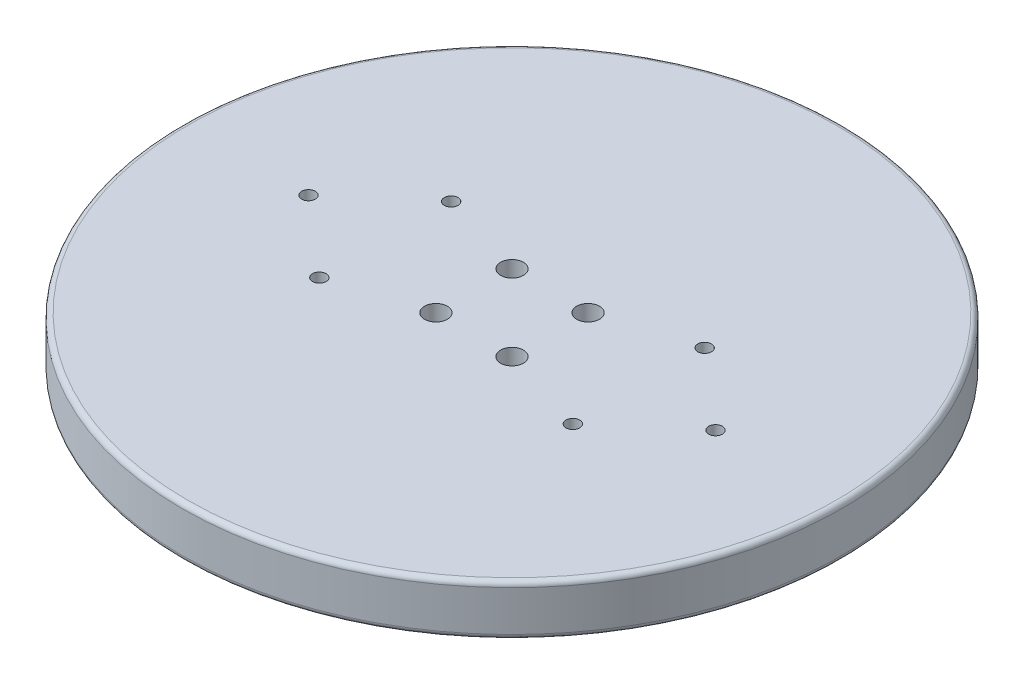
from build123d import *

# Parameters (mm, degrees)
SKETCH1_R             = 65
BOSS_EXTRUDE1_DEPTH   = 10
FILLET1_R             = 1
F_6_32_TAPPED_HOLE1_D = 2.7051
F_8_CLEARANCE_HOLE1_D = 4.4958


with BuildPart() as part:
    # Sketch1 → Boss-Extrude1 (new body)
    with BuildSketch(Plane(origin=(0, 0, 0), x_dir=(1, 0, 0), z_dir=(0, 1, 0))):
        with Locations(Location((0, 0, 0), (0, 0, 270))):
            Circle(SKETCH1_R)
    extrude(amount=BOSS_EXTRUDE1_DEPTH)

    # Fillet1
    fillet1_edges = [part.edges().sort_by_distance(p)[0] for p in [
        (0, 0, -65),
        (0, 10, -65),
    ]]
    fillet(fillet1_edges, radius=FILLET1_R)

    # #6-32 Tapped Hole1 (through all)
    with Locations(Plane.XZ):
        with Locations((-40.14, 0), (40.14, 0), (-25, -13), (-25, 13), (25, 13), (25, -13)):
            Hole(F_6_32_TAPPED_HOLE1_D / 2)

    # #8 Clearance Hole1 (through all)
    with Locations(Plane(origin=(0, 0, 0), x_dir=(-1, 0, 0), z_dir=(0, -1, 0))):
        with Locations((7.5, -7.5), (-7.5, -7.5), (7.5, 7.5), (-7.5, 7.5)):
            Hole(F_8_CLEARANCE_HOLE1_D / 2)


solid = part.part
